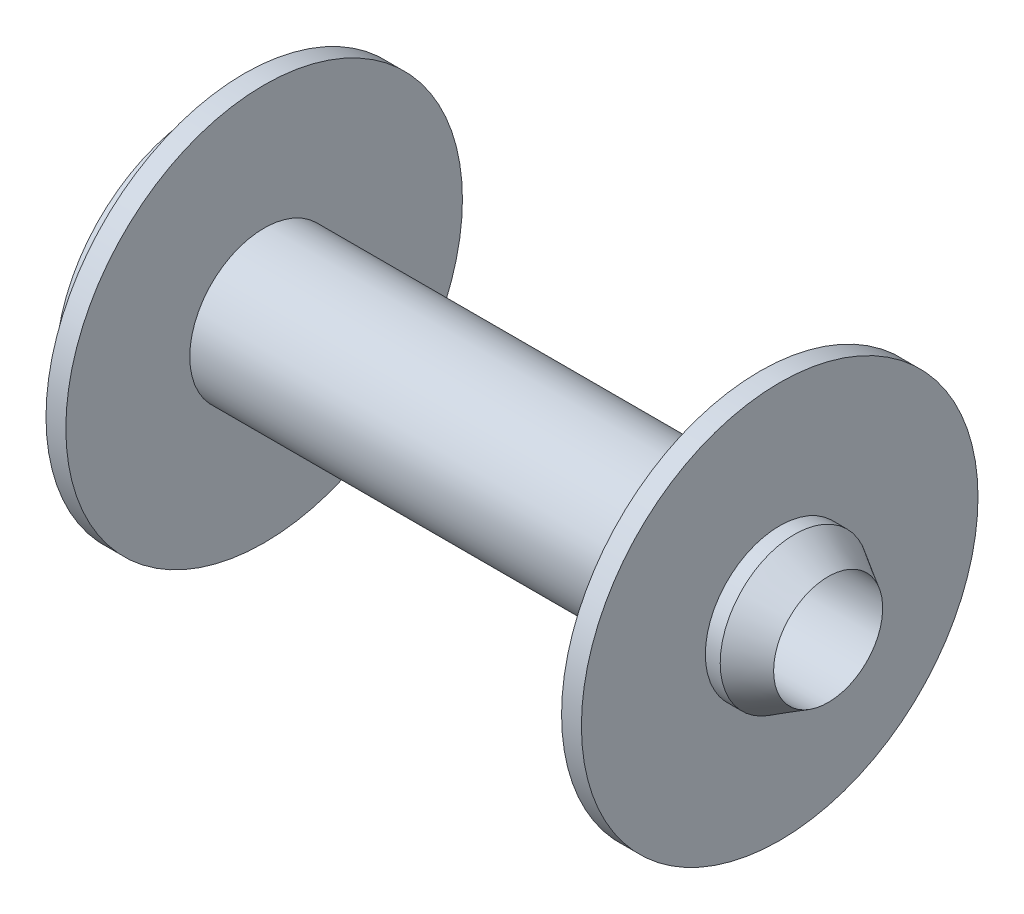
from build123d import *


with BuildPart() as part:
    # Sketch1 → Revolve1 (revolve)
    with BuildSketch(Plane.XY, mode=Mode.PRIVATE) as revolve1_sk:
        Polygon((63.772581868, 11), (57, 15), (54, 15), (54, 40), (50, 40), (50, 15), (-50, 15), (-50, 40), (-54, 40), (-54, 15), (-57, 15), (-57, 30), (-62, 30), (-62, 15), (-65.107867805, 11), align=None)
    revolve(revolve1_sk.sketch.rotate(Axis((-22.229254667, 0, 0), (1, 0, 0)), 90), axis=Axis((-22.229254667, 0, 0), (1, 0, 0)))


solid = part.part
